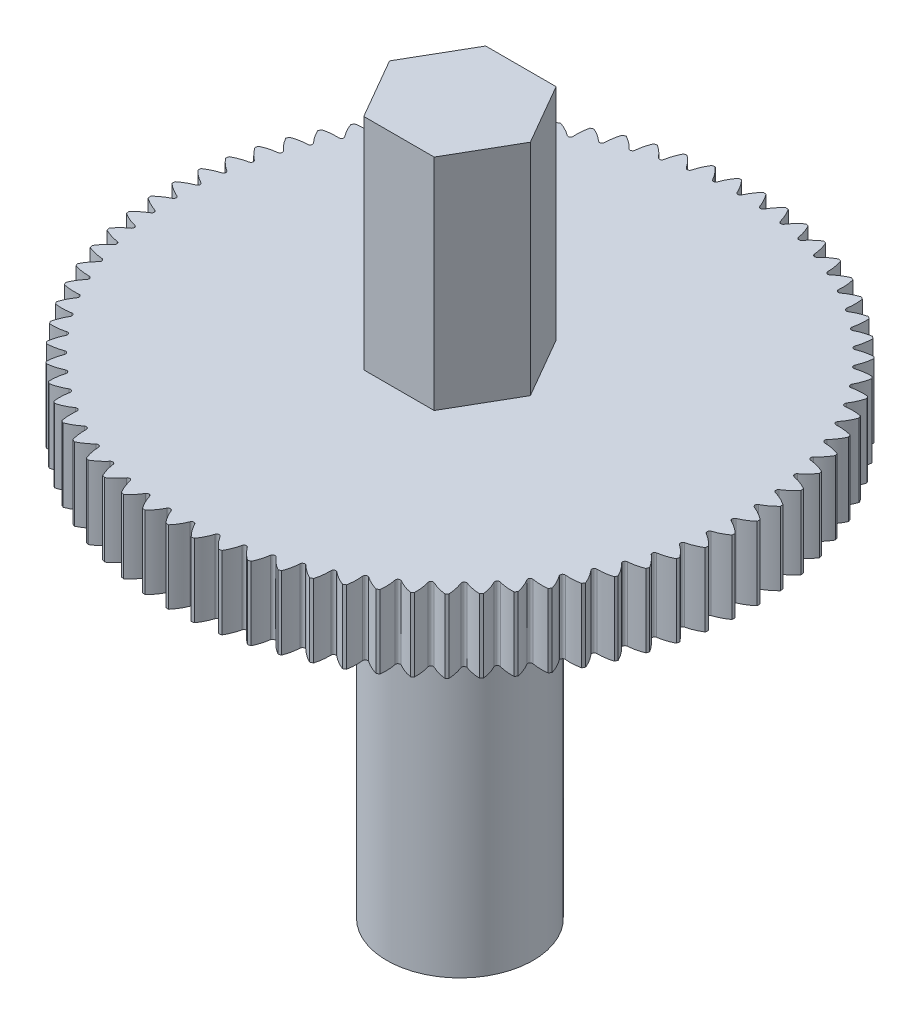
from build123d import *

# Parameters (mm, degrees)
KES_EKSTR_ZYON1_DEPTH = 6
KES_EKSTR_ZYON2_START = -9
IZIM3_R               = 3
KES_EKSTR_ZYON2_DEPTH = 9


with BuildPart() as part:
    # Çizim1 → Döndür1 (revolve)
    with BuildSketch(Plane.XY, mode=Mode.PRIVATE) as d_nd_r1_sk:
        Polygon((0, 0), (0, 29), (3, 29), (3, 20), (12, 20), (12, 17), (3, 17), (3, 0), align=None)
    revolve(d_nd_r1_sk.sketch.rotate(Axis((0, 0, 0), (0, 1, 0)), 90), axis=Axis((0, 0, 0), (0, 1, 0)))

    # Çizim2 → Kes-Ekstrüzyon1 (cut)
    with BuildSketch(Plane(origin=(0, 20, 0), x_dir=(1, 0, 0), z_dir=(0, 1, 0))):
        with BuildLine():
            Line((0.45, 12), (-0.45, 12))
            ThreePointArc((-0.45, 12), (-0.248504486, 11.744148972), (-0.091203345, 11.458988418))
            ThreePointArc((-0.091203345, 11.458988418), (0, 11.4), (0.091203345, 11.458988418))
            ThreePointArc((0.091203345, 11.458988418), (0.248504486, 11.744148972), (0.45, 12))
        make_face()
        with BuildLine():
            Line((1.452555907, 11.920259281), (0.555712333, 11.99556934))
            ThreePointArc((0.555712333, 11.99556934), (0.735092112, 11.723754908), (0.867979956, 11.426431832))
            ThreePointArc((0.867979956, 11.426431832), (0.953927414, 11.360018595), (1.04974692, 11.411168434))
            ThreePointArc((1.04974692, 11.411168434), (1.230358003, 11.682166269), (1.452555907, 11.920259281))
        make_face()
        with BuildLine():
            Line((2.444923177, 11.756906509), (1.557526744, 11.906998381))
            ThreePointArc((1.557526744, 11.906998381), (1.713532567, 11.621127127), (1.821075, 11.313727037))
            ThreePointArc((1.821075, 11.313727037), (1.901163713, 11.240354823), (2.000927274, 11.283307301))
            ThreePointArc((2.000927274, 11.283307301), (2.203581444, 11.538241564), (2.444923177, 11.756906509))
        make_face()
        with BuildLine():
            Line((3.420141068, 11.511087484), (2.548416223, 11.734908383))
            ThreePointArc((2.548416223, 11.734908383), (2.679953822, 11.436985489), (2.761396512, 11.121664575))
            ThreePointArc((2.761396512, 11.121664575), (2.835064714, 11.041848037), (2.938072561, 11.076301876))
            ThreePointArc((2.938072561, 11.076301876), (3.161348343, 11.313384384), (3.420141068, 11.511087484))
        make_face()
        with BuildLine():
            Line((4.371369127, 11.184526452), (3.521430394, 11.480506434))
            ThreePointArc((3.521430394, 11.480506434), (3.627577127, 11.172621615), (3.682348812, 10.851591627))
            ThreePointArc((3.682348812, 10.851591627), (3.749079773, 10.765890621), (3.85460938, 10.791604151))
            ThreePointArc((3.85460938, 10.791604151), (4.096940656, 11.009171941), (4.371369127, 11.184526452))
        make_face()
        with BuildLine():
            Line((5.291935173, 10.779514002), (4.469744261, 11.145576981))
            ThreePointArc((4.469744261, 11.145576981), (4.549755585, 10.829889828), (4.577472081, 10.505402561))
            ThreePointArc((4.577472081, 10.505402561), (4.636797731, 10.414418217), (4.744108884, 10.431211076))
            ThreePointArc((4.744108884, 10.431211076), (5.003795873, 10.627738067), (5.291935173, 10.779514002))
        make_face()
        with BuildLine():
            Line((6.175382095, 10.298891007), (5.386706083, 10.732469314))
            ThreePointArc((5.386706083, 10.732469314), (5.440020776, 10.411194145), (5.440487671, 10.085525644))
            ThreePointArc((5.440487671, 10.085525644), (5.491991885, 9.989896153), (5.600331872, 9.997650551))
            ThreePointArc((5.600331872, 9.997650551), (5.875553058, 10.171758247), (6.175382095, 10.298891007))
        make_face()
        with BuildLine():
            Line((7.015513149, 9.746028691), (6.265884033, 10.244081086))
            ThreePointArc((6.265884033, 10.244081086), (6.29212813, 9.919471416), (6.26534215, 9.594906011))
            ThreePointArc((6.26534215, 9.594906011), (6.308663661, 9.495302144), (6.417272557, 9.49396369))
            ThreePointArc((6.417272557, 9.49396369), (6.706097459, 9.644430851), (7.015513149, 9.746028691))
        make_face()
        with BuildLine():
            Line((7.806435419, 9.124804987), (7.101111308, 9.683837989))
            ThreePointArc((7.101111308, 9.683837989), (7.100100726, 9.358170721), (7.046249755, 9.036985006))
            ThreePointArc((7.046249755, 9.036985006), (7.081084695, 8.934105414), (7.189200685, 8.923683495))
            ThreePointArc((7.189200685, 8.923683495), (7.489603405, 9.049454702), (7.806435419, 9.124804987))
        make_face()
        with BuildLine():
            Line((8.542601153, 8.439577331), (7.886529389, 9.055669727))
            ThreePointArc((7.886529389, 9.055669727), (7.858271217, 8.731229183), (7.777732981, 8.415676045))
            ThreePointArc((7.777732981, 8.415676045), (7.803837008, 8.310242353), (7.910701736, 8.290810073))
            ThreePointArc((7.910701736, 8.290810073), (8.220575165, 8.39100313), (8.542601153, 8.439577331))
        make_face()
        with BuildLine():
            Line((9.218846679, 7.695152105), (8.616629133, 8.363982448))
            ThreePointArc((8.616629133, 8.363982448), (8.561321581, 8.043044346), (8.454660999, 7.735337162))
            ThreePointArc((8.454660999, 7.735337162), (8.47185101, 7.628088912), (8.576714898, 7.599782574))
            ThreePointArc((8.576714898, 7.599782574), (8.893885496, 7.6736947), (9.218846679, 7.695152105))
        make_face()
        with BuildLine():
            Line((9.830428618, 6.896750915), (9.286289415, 7.613627841))
            ThreePointArc((9.286289415, 7.613627841), (9.204320426, 7.298443331), (9.072285644, 7.000740448))
            ThreePointArc((9.072285644, 7.000740448), (9.080441065, 6.892429909), (9.182568567, 6.855448062))
            ThreePointArc((9.182568567, 6.855448062), (9.50481161, 6.902560816), (9.830428618, 6.896750915))
        make_face()
        with BuildLine():
            Line((10.373057164, 6.049973973), (9.890813048, 6.809869106))
            ThreePointArc((9.890813048, 6.809869106), (9.782757576, 6.502648981), (9.626274723, 6.217038569))
            ThreePointArc((9.626274723, 6.217038569), (9.625338351, 6.108425463), (9.724013115, 6.063027507))
            ThreePointArc((9.724013115, 6.063027507), (10.049068301, 6.083010427), (10.373057164, 6.049973973))
        make_face()
        with BuildLine():
            Line((10.842926167, 5.160760811), (10.425959735, 5.958344032))
            ThreePointArc((10.425959735, 5.958344032), (10.292575711, 5.661243219), (10.112742402, 5.389728631))
            ThreePointArc((10.112742402, 5.389728631), (10.102720803, 5.2815748), (10.197250699, 5.22807917))
            ThreePointArc((10.197250699, 5.22807917), (10.522837997, 5.22079209), (10.842926167, 5.160760811))
        make_face()
        with BuildLine():
            Line((11.236739833, 4.235348619), (10.887975805, 5.065025456))
            ThreePointArc((10.887975805, 5.065025456), (10.730198823, 4.780127905), (10.528276459, 4.52461362))
            ThreePointArc((10.528276459, 4.52461362), (10.509239928, 4.417677686), (10.598961895, 4.356459614))
            ThreePointArc((10.598961895, 4.356459614), (10.922797546, 4.321953648), (11.236739833, 4.235348619))
        make_face()
        with BuildLine():
            Line((11.551735843, 3.2802285), (11.273620548, 4.136179365))
            ThreePointArc((11.273620548, 4.136179365), (11.092557299, 3.865483427), (10.869962222, 3.627761695))
            ThreePointArc((10.869962222, 3.627761695), (10.842044286, 3.522793736), (10.926328989, 3.454282624))
            ThreePointArc((10.926328989, 3.454282624), (11.246141518, 3.392799806), (11.551735843, 3.2802285))
        make_face()
        with BuildLine():
            Line((11.785704726, 2.302099935), (11.580188943, 3.178320948))
            ThreePointArc((11.580188943, 3.178320948), (11.377109456, 2.923725361), (11.135403009, 2.705463628))
            ThreePointArc((11.135403009, 2.705463628), (11.098799493, 2.603199919), (11.177055735, 2.527876323))
            ThreePointArc((11.177055735, 2.527876323), (11.490601887, 2.439847912), (11.785704726, 2.302099935))
        make_face()
        with BuildLine():
            Line((11.937005358, 1.307823793), (11.805530633, 2.198168893))
            ThreePointArc((11.805530633, 2.198168893), (11.581859365, 1.961459462), (11.322736945, 1.764188678))
            ThreePointArc((11.322736945, 1.764188678), (11.277704596, 1.665346526), (11.349383467, 1.583738786))
            ThreePointArc((11.349383467, 1.583738786), (11.65446394, 1.469782237), (11.937005358, 1.307823793))
        make_face()
        with BuildLine():
            Line((12.004576475, 0.304374207), (11.948065007, 1.202598262))
            ThreePointArc((11.948065007, 1.202598262), (11.705370851, 0.985435334), (11.430650017, 0.810539212))
            ThreePointArc((11.430650017, 0.810539212), (11.377504704, 0.715811923), (11.442103427, 0.62849246))
            ThreePointArc((11.442103427, 0.62849246), (11.736578303, 0.489407097), (12.004576475, 0.304374207))
        make_face()
        with BuildLine():
            Line((11.987944113, -0.701210346), (12.006792291, 0.198592269))
            ThreePointArc((12.006792291, 0.198592269), (11.746777572, 0.002499086), (11.458385291, -0.148795604))
            ThreePointArc((11.458385291, -0.148795604), (11.397499792, -0.238743587), (11.454565254, -0.33116229))
            ThreePointArc((11.454565254, -0.33116229), (11.736369001, -0.494400884), (11.987944113, -0.701210346))
        make_face()
        with BuildLine():
            Line((11.887224936, -1.701876412), (11.981300553, -0.806806706))
            ThreePointArc((11.981300553, -0.806806706), (11.705789087, -0.980454692), (11.405748226, -1.107086726))
            ThreePointArc((11.405748226, -1.107086726), (11.337549607, -1.191624481), (11.386681535, -1.288494174))
            ThreePointArc((11.386681535, -1.288494174), (11.653837503, -1.474740997), (11.887224936, -1.701876412))
        make_face()
        with BuildLine():
            Line((11.703125417, -2.690605038), (11.8717686, -1.806546512))
            ThreePointArc((11.8717686, -1.806546512), (11.582692903, -1.956531285), (11.273108032, -2.057612431))
            ThreePointArc((11.273108032, -2.057612431), (11.198074658, -2.136146986), (11.238928427, -2.236788197))
            ThreePointArc((11.238928427, -2.236788197), (11.489562709, -2.444736861), (11.703125417, -2.690605038))
        make_face()
        with BuildLine():
            Line((11.436936882, -3.660461002), (11.678964721, -2.793614692))
            ThreePointArc((11.678964721, -2.793614692), (11.378352451, -2.918884217), (11.061395085, -2.993705462))
            ThreePointArc((11.061395085, -2.993705462), (10.980053261, -3.065685955), (11.01234231, -3.169392758))
            ThreePointArc((11.01234231, -3.169392758), (11.244696887, -3.397584653), (11.436936882, -3.660461002))
        make_face()
        with BuildLine():
            Line((11.090526453, -4.604641463), (11.404241295, -3.761087673))
            ThreePointArc((11.404241295, -3.761087673), (11.094201031, -3.860763273), (10.772094399, -3.9087998))
            ThreePointArc((10.772094399, -3.9087998), (10.68501468, -3.973721339), (10.708512525, -4.079766306))
            ThreePointArc((10.708512525, -4.079766306), (10.920957596, -4.32660083), (11.090526453, -4.604641463))
        make_face()
        with BuildLine():
            Line((10.666323948, -5.516523672), (11.049525311, -4.702179325))
            ThreePointArc((11.049525311, -4.702179325), (10.732231762, -4.775561848), (10.40723521, -4.796476717))
            ThreePointArc((10.40723521, -4.796476717), (10.315028398, -4.853883924), (10.329570219, -4.961523225))
            ThreePointArc((10.329570219, -4.961523225), (10.520615634, -5.225269011), (10.666323948, -5.516523672))
        make_face()
        with BuildLine():
            Line((10.167304845, -6.389711432), (10.617304845, -5.610288568))
            ThreePointArc((10.617304845, -5.610288568), (10.294983599, -5.656863289), (9.969376744, -5.650509795))
            ThreePointArc((9.969376744, -5.650509795), (9.872689603, -5.7), (9.878173399, -5.808478623))
            ThreePointArc((9.878173399, -5.808478623), (10.046479113, -6.087285684), (10.167304845, -6.389711432))
        make_face()
        with BuildLine():
            Line((9.596969404, -7.218079956), (10.110611615, -6.479045668))
            ThreePointArc((10.110611615, -6.479045668), (9.785523522, -6.498485898), (9.461590263, -6.464908607))
            ThreePointArc((9.461590263, -6.464908607), (9.361100984, -6.506134672), (9.357488291, -6.614691717))
            ThreePointArc((9.357488291, -6.614691717), (9.501873759, -6.906604421), (9.596969404, -7.218079956))
        make_face()
        with BuildLine():
            Line((8.959318118, -7.995818836), (9.532999709, -7.302356918))
            ThreePointArc((9.532999709, -7.302356918), (9.207425029, -7.294526297), (8.887437525, -7.233960731))
            ThreePointArc((8.887437525, -7.233960731), (8.783850968, -7.266633483), (8.771167125, -7.374507501))
            ThreePointArc((8.771167125, -7.374507501), (8.890619588, -7.677478291), (8.959318118, -7.995818836))
        make_face()
        with BuildLine():
            Line((8.258823652, -8.717472792), (8.888520659, -8.07444738))
            ThreePointArc((8.888520659, -8.07444738), (8.564743065, -8.039400836), (8.250945798, -7.952271817))
            ThreePointArc((8.250945798, -7.952271817), (8.144988548, -7.976162082), (8.123322524, -8.082596414))
            ThreePointArc((8.123322524, -8.082596414), (8.217004108, -8.394500167), (8.258823652, -8.717472792))
        make_face()
        with BuildLine():
            Line((7.500399473, -9.37797994), (8.181695023, -8.789901396))
            ThreePointArc((8.181695023, -8.789901396), (7.861985582, -8.727884754), (7.556579614, -8.61480343))
            ThreePointArc((7.556579614, -8.61480343), (7.448994885, -8.629743634), (7.418498652, -8.73399172))
            ThreePointArc((7.418498652, -8.73399172), (7.485752248, -9.052640656), (7.500399473, -9.37797994))
        make_face()
        with BuildLine():
            Line((6.68936538, -9.972707296), (7.417480675, -9.443700569))
            ThreePointArc((7.417480675, -9.443700569), (7.104081919, -9.355148831), (6.809209454, -9.216908387))
            ThreePointArc((6.809209454, -9.216908387), (6.700751876, -9.222793736), (6.661639342, -9.32412435))
            ThreePointArc((6.661639342, -9.32412435), (6.701993215, -9.647283375), (6.68936538, -9.972707296))
        make_face()
        with BuildLine():
            Line((5.831410195, -10.497483276), (6.60123803, -10.031258968))
            ThreePointArc((6.60123803, -10.031258968), (6.296348225, -9.916793261), (6.014077582, -9.754363354))
            ThreePointArc((6.014077582, -9.754363354), (5.905507907, -9.751152566), (5.858053419, -9.848854946))
            ThreePointArc((5.858053419, -9.848854946), (5.871224514, -10.174257333), (5.831410195, -10.497483276))
        make_face()
        with BuildLine():
            Line((4.932551858, -10.948626954), (5.738692442, -10.548455292))
            ThreePointArc((5.738692442, -10.548455292), (5.444450173, -10.408878512), (5.176761277, -10.223398471))
            ThreePointArc((5.176761277, -10.223398471), (5.068841043, -10.211114067), (5.01337746, -10.304502902))
            ThreePointArc((5.01337746, -10.304502902), (4.999273392, -10.629866185), (4.932551858, -10.948626954))
        make_face()
        with BuildLine():
            Line((3.999095214, -11.322973879), (4.835894051, -10.991661782))
            ThreePointArc((4.835894051, -10.991661782), (4.554363215, -10.827952959), (4.303133711, -10.620723793))
            ThreePointArc((4.303133711, -10.620723793), (4.196619901, -10.599451939), (4.13353626, -10.687872174))
            ThreePointArc((4.13353626, -10.687872174), (4.09225596, -11.010914164), (3.999095214, -11.322973879))
        make_face()
        with BuildLine():
            Line((3.037587789, -11.617898279), (3.899175337, -11.357769662))
            ThreePointArc((3.899175337, -11.357769662), (3.63233067, -11.171077095), (3.399322754, -10.943552368))
            ThreePointArc((3.399322754, -10.943552368), (3.294962485, -10.913442272), (3.224701273, -10.996273701))
            ThreePointArc((3.224701273, -10.996273701), (3.156534292, -11.314728491), (3.037587789, -11.617898279))
        make_face()
        with BuildLine():
            Line((2.054773869, -11.83133147), (2.93510671, -11.644210948))
            ThreePointArc((2.93510671, -11.644210948), (2.684819937, -11.435844152), (2.47166799, -11.189619786))
            ThreePointArc((2.47166799, -11.189619786), (2.370193275, -11.150882648), (2.293247324, -11.22754427))
            ThreePointArc((2.293247324, -11.22754427), (2.198671804, -11.539178128), (2.054773869, -11.83133147))
        make_face()
        with BuildLine():
            Line((1.057547187, -11.961776371), (1.950450418, -11.848976461))
            ThreePointArc((1.950450418, -11.848976461), (1.71847712, -11.620396979), (1.526676251, -11.357200062))
            ThreePointArc((1.526676251, -11.357200062), (1.428798863, -11.310107595), (1.345707892, -11.380061682))
            ThreePointArc((1.345707892, -11.380061682), (1.225387213, -11.682688721), (1.057547187, -11.961776371))
        make_face()
        with BuildLine():
            Line((0.052902571, -12.008318005), (0.952113118, -11.970629917))
            ThreePointArc((0.952113118, -11.970629917), (0.740080421, -11.723441071), (0.570975975, -11.445117739))
            ThreePointArc((0.570975975, -11.445117739), (0.477382453, -11.390000263), (0.388729287, -11.452756138))
            ThreePointArc((0.388729287, -11.452756138), (0.243507411, -11.744253646), (0.052902571, -12.008318005))
        make_face()
        with BuildLine():
            Line((-0.952113118, -11.970629917), (-0.052902571, -12.008318005))
            ThreePointArc((-0.052902571, -12.008318005), (-0.243507411, -11.744253646), (-0.388729287, -11.452756138))
            ThreePointArc((-0.388729287, -11.452756138), (-0.477382453, -11.390000263), (-0.570975975, -11.445117739))
            ThreePointArc((-0.570975975, -11.445117739), (-0.740080421, -11.723441071), (-0.952113118, -11.970629917))
        make_face()
        with BuildLine():
            Line((-1.950450418, -11.848976461), (-1.057547187, -11.961776371))
            ThreePointArc((-1.057547187, -11.961776371), (-1.225387213, -11.682688721), (-1.345707892, -11.380061682))
            ThreePointArc((-1.345707892, -11.380061682), (-1.428798863, -11.310107595), (-1.526676251, -11.357200062))
            ThreePointArc((-1.526676251, -11.357200062), (-1.71847712, -11.620396979), (-1.950450418, -11.848976461))
        make_face()
        with BuildLine():
            Line((-2.93510671, -11.644210948), (-2.054773869, -11.83133147))
            ThreePointArc((-2.054773869, -11.83133147), (-2.198671804, -11.539178128), (-2.293247324, -11.22754427))
            ThreePointArc((-2.293247324, -11.22754427), (-2.370193275, -11.150882648), (-2.47166799, -11.189619786))
            ThreePointArc((-2.47166799, -11.189619786), (-2.684819937, -11.435844152), (-2.93510671, -11.644210948))
        make_face()
        with BuildLine():
            Line((-3.899175337, -11.357769662), (-3.037587789, -11.617898279))
            ThreePointArc((-3.037587789, -11.617898279), (-3.156534292, -11.314728491), (-3.224701273, -10.996273701))
            ThreePointArc((-3.224701273, -10.996273701), (-3.294962485, -10.913442272), (-3.399322754, -10.943552368))
            ThreePointArc((-3.399322754, -10.943552368), (-3.63233067, -11.171077095), (-3.899175337, -11.357769662))
        make_face()
        with BuildLine():
            Line((-4.835894051, -10.991661782), (-3.999095214, -11.322973879))
            ThreePointArc((-3.999095214, -11.322973879), (-4.09225596, -11.010914164), (-4.13353626, -10.687872174))
            ThreePointArc((-4.13353626, -10.687872174), (-4.196619901, -10.599451939), (-4.303133711, -10.620723793))
            ThreePointArc((-4.303133711, -10.620723793), (-4.554363215, -10.827952959), (-4.835894051, -10.991661782))
        make_face()
        with BuildLine():
            Line((-5.738692442, -10.548455292), (-4.932551858, -10.948626954))
            ThreePointArc((-4.932551858, -10.948626954), (-4.999273392, -10.629866185), (-5.01337746, -10.304502902))
            ThreePointArc((-5.01337746, -10.304502902), (-5.068841043, -10.211114067), (-5.176761277, -10.223398471))
            ThreePointArc((-5.176761277, -10.223398471), (-5.444450173, -10.408878512), (-5.738692442, -10.548455292))
        make_face()
        with BuildLine():
            Line((-6.60123803, -10.031258968), (-5.831410195, -10.497483276))
            ThreePointArc((-5.831410195, -10.497483276), (-5.871224514, -10.174257333), (-5.858053419, -9.848854946))
            ThreePointArc((-5.858053419, -9.848854946), (-5.905507907, -9.751152566), (-6.014077582, -9.754363354))
            ThreePointArc((-6.014077582, -9.754363354), (-6.296348225, -9.916793261), (-6.60123803, -10.031258968))
        make_face()
        with BuildLine():
            Line((-7.417480675, -9.443700569), (-6.68936538, -9.972707296))
            ThreePointArc((-6.68936538, -9.972707296), (-6.701993215, -9.647283375), (-6.661639342, -9.32412435))
            ThreePointArc((-6.661639342, -9.32412435), (-6.700751876, -9.222793736), (-6.809209454, -9.216908387))
            ThreePointArc((-6.809209454, -9.216908387), (-7.104081919, -9.355148831), (-7.417480675, -9.443700569))
        make_face()
        with BuildLine():
            Line((-8.181695023, -8.789901396), (-7.500399473, -9.37797994))
            ThreePointArc((-7.500399473, -9.37797994), (-7.485752248, -9.052640656), (-7.418498652, -8.73399172))
            ThreePointArc((-7.418498652, -8.73399172), (-7.448994885, -8.629743634), (-7.556579614, -8.61480343))
            ThreePointArc((-7.556579614, -8.61480343), (-7.861985582, -8.727884754), (-8.181695023, -8.789901396))
        make_face()
        with BuildLine():
            Line((-8.888520659, -8.07444738), (-8.258823652, -8.717472792))
            ThreePointArc((-8.258823652, -8.717472792), (-8.217004108, -8.394500167), (-8.123322524, -8.082596414))
            ThreePointArc((-8.123322524, -8.082596414), (-8.144988548, -7.976162082), (-8.250945798, -7.952271817))
            ThreePointArc((-8.250945798, -7.952271817), (-8.564743065, -8.039400836), (-8.888520659, -8.07444738))
        make_face()
        with BuildLine():
            Line((-9.532999709, -7.302356918), (-8.959318118, -7.995818836))
            ThreePointArc((-8.959318118, -7.995818836), (-8.890619588, -7.677478291), (-8.771167125, -7.374507501))
            ThreePointArc((-8.771167125, -7.374507501), (-8.783850968, -7.266633483), (-8.887437525, -7.233960731))
            ThreePointArc((-8.887437525, -7.233960731), (-9.207425029, -7.294526297), (-9.532999709, -7.302356918))
        make_face()
        with BuildLine():
            Line((-10.110611615, -6.479045668), (-9.596969404, -7.218079956))
            ThreePointArc((-9.596969404, -7.218079956), (-9.501873759, -6.906604421), (-9.357488291, -6.614691717))
            ThreePointArc((-9.357488291, -6.614691717), (-9.361100984, -6.506134672), (-9.461590263, -6.464908607))
            ThreePointArc((-9.461590263, -6.464908607), (-9.785523522, -6.498485898), (-10.110611615, -6.479045668))
        make_face()
        with BuildLine():
            Line((-10.617304845, -5.610288568), (-10.167304845, -6.389711432))
            ThreePointArc((-10.167304845, -6.389711432), (-10.046479113, -6.087285684), (-9.878173399, -5.808478623))
            ThreePointArc((-9.878173399, -5.808478623), (-9.872689603, -5.7), (-9.969376744, -5.650509795))
            ThreePointArc((-9.969376744, -5.650509795), (-10.294983599, -5.656863289), (-10.617304845, -5.610288568))
        make_face()
        with BuildLine():
            Line((-11.049525311, -4.702179325), (-10.666323948, -5.516523672))
            ThreePointArc((-10.666323948, -5.516523672), (-10.520615634, -5.225269011), (-10.329570219, -4.961523225))
            ThreePointArc((-10.329570219, -4.961523225), (-10.315028398, -4.853883924), (-10.40723521, -4.796476717))
            ThreePointArc((-10.40723521, -4.796476717), (-10.732231762, -4.775561848), (-11.049525311, -4.702179325))
        make_face()
        with BuildLine():
            Line((-11.404241295, -3.761087673), (-11.090526453, -4.604641463))
            ThreePointArc((-11.090526453, -4.604641463), (-10.920957596, -4.32660083), (-10.708512525, -4.079766306))
            ThreePointArc((-10.708512525, -4.079766306), (-10.68501468, -3.973721339), (-10.772094399, -3.9087998))
            ThreePointArc((-10.772094399, -3.9087998), (-11.094201031, -3.860763273), (-11.404241295, -3.761087673))
        make_face()
        with BuildLine():
            Line((-11.678964721, -2.793614692), (-11.436936882, -3.660461002))
            ThreePointArc((-11.436936882, -3.660461002), (-11.244696887, -3.397584653), (-11.01234231, -3.169392758))
            ThreePointArc((-11.01234231, -3.169392758), (-10.980053261, -3.065685955), (-11.061395085, -2.993705462))
            ThreePointArc((-11.061395085, -2.993705462), (-11.378352451, -2.918884217), (-11.678964721, -2.793614692))
        make_face()
        with BuildLine():
            Line((-11.8717686, -1.806546512), (-11.703125417, -2.690605038))
            ThreePointArc((-11.703125417, -2.690605038), (-11.489562709, -2.444736861), (-11.238928427, -2.236788197))
            ThreePointArc((-11.238928427, -2.236788197), (-11.198074658, -2.136146986), (-11.273108032, -2.057612431))
            ThreePointArc((-11.273108032, -2.057612431), (-11.582692903, -1.956531285), (-11.8717686, -1.806546512))
        make_face()
        with BuildLine():
            Line((-11.981300553, -0.806806706), (-11.887224936, -1.701876412))
            ThreePointArc((-11.887224936, -1.701876412), (-11.653837503, -1.474740997), (-11.386681535, -1.288494174))
            ThreePointArc((-11.386681535, -1.288494174), (-11.337549607, -1.191624481), (-11.405748226, -1.107086726))
            ThreePointArc((-11.405748226, -1.107086726), (-11.705789087, -0.980454692), (-11.981300553, -0.806806706))
        make_face()
        with BuildLine():
            Line((-12.006792291, 0.198592269), (-11.987944113, -0.701210346))
            ThreePointArc((-11.987944113, -0.701210346), (-11.736369001, -0.494400884), (-11.454565254, -0.33116229))
            ThreePointArc((-11.454565254, -0.33116229), (-11.397499792, -0.238743587), (-11.458385291, -0.148795604))
            ThreePointArc((-11.458385291, -0.148795604), (-11.746777572, 0.002499086), (-12.006792291, 0.198592269))
        make_face()
        with BuildLine():
            Line((-11.948065007, 1.202598262), (-12.004576475, 0.304374207))
            ThreePointArc((-12.004576475, 0.304374207), (-11.736578303, 0.489407096), (-11.442103427, 0.62849246))
            ThreePointArc((-11.442103427, 0.62849246), (-11.377504704, 0.715811923), (-11.430650017, 0.810539212))
            ThreePointArc((-11.430650017, 0.810539212), (-11.705370851, 0.985435334), (-11.948065007, 1.202598262))
        make_face()
        with BuildLine():
            Line((-11.805530633, 2.198168893), (-11.937005358, 1.307823793))
            ThreePointArc((-11.937005358, 1.307823793), (-11.65446394, 1.469782237), (-11.349383467, 1.583738786))
            ThreePointArc((-11.349383467, 1.583738786), (-11.277704596, 1.665346526), (-11.322736945, 1.764188678))
            ThreePointArc((-11.322736945, 1.764188678), (-11.581859365, 1.961459462), (-11.805530633, 2.198168893))
        make_face()
        with BuildLine():
            Line((-11.580188943, 3.178320948), (-11.785704726, 2.302099935))
            ThreePointArc((-11.785704726, 2.302099935), (-11.490601887, 2.439847912), (-11.177055735, 2.527876323))
            ThreePointArc((-11.177055735, 2.527876323), (-11.098799493, 2.603199919), (-11.135403009, 2.705463628))
            ThreePointArc((-11.135403009, 2.705463628), (-11.377109456, 2.923725361), (-11.580188943, 3.178320948))
        make_face()
        with BuildLine():
            Line((-11.273620548, 4.136179365), (-11.551735843, 3.2802285))
            ThreePointArc((-11.551735843, 3.2802285), (-11.246141518, 3.392799806), (-10.926328989, 3.454282624))
            ThreePointArc((-10.926328989, 3.454282624), (-10.842044286, 3.522793736), (-10.869962222, 3.627761695))
            ThreePointArc((-10.869962222, 3.627761695), (-11.092557299, 3.865483427), (-11.273620548, 4.136179365))
        make_face()
        with BuildLine():
            Line((-10.887975805, 5.065025456), (-11.236739833, 4.235348619))
            ThreePointArc((-11.236739833, 4.235348619), (-10.922797546, 4.321953648), (-10.598961895, 4.356459614))
            ThreePointArc((-10.598961895, 4.356459614), (-10.509239928, 4.417677686), (-10.528276459, 4.52461362))
            ThreePointArc((-10.528276459, 4.52461362), (-10.730198823, 4.780127905), (-10.887975805, 5.065025456))
        make_face()
        with BuildLine():
            Line((-10.425959735, 5.958344032), (-10.842926167, 5.160760811))
            ThreePointArc((-10.842926167, 5.160760811), (-10.522837997, 5.22079209), (-10.197250699, 5.22807917))
            ThreePointArc((-10.197250699, 5.22807917), (-10.102720803, 5.2815748), (-10.112742402, 5.389728631))
            ThreePointArc((-10.112742402, 5.389728631), (-10.292575711, 5.661243219), (-10.425959735, 5.958344032))
        make_face()
        with BuildLine():
            Line((-9.890813048, 6.809869106), (-10.373057164, 6.049973973))
            ThreePointArc((-10.373057164, 6.049973973), (-10.049068301, 6.083010427), (-9.724013115, 6.063027507))
            ThreePointArc((-9.724013115, 6.063027507), (-9.625338351, 6.108425463), (-9.626274723, 6.217038569))
            ThreePointArc((-9.626274723, 6.217038569), (-9.782757576, 6.502648981), (-9.890813048, 6.809869106))
        make_face()
        with BuildLine():
            Line((-9.286289415, 7.613627841), (-9.830428618, 6.896750915))
            ThreePointArc((-9.830428618, 6.896750915), (-9.50481161, 6.902560816), (-9.182568567, 6.855448062))
            ThreePointArc((-9.182568567, 6.855448062), (-9.080441065, 6.892429909), (-9.072285644, 7.000740448))
            ThreePointArc((-9.072285644, 7.000740448), (-9.204320426, 7.298443331), (-9.286289415, 7.613627841))
        make_face()
        with BuildLine():
            Line((-8.616629133, 8.363982448), (-9.218846679, 7.695152105))
            ThreePointArc((-9.218846679, 7.695152105), (-8.893885496, 7.6736947), (-8.576714898, 7.599782574))
            ThreePointArc((-8.576714898, 7.599782574), (-8.47185101, 7.628088912), (-8.454660999, 7.735337162))
            ThreePointArc((-8.454660999, 7.735337162), (-8.561321581, 8.043044346), (-8.616629133, 8.363982448))
        make_face()
        with BuildLine():
            Line((-7.886529389, 9.055669727), (-8.542601153, 8.439577331))
            ThreePointArc((-8.542601153, 8.439577331), (-8.220575165, 8.39100313), (-7.910701736, 8.290810073))
            ThreePointArc((-7.910701736, 8.290810073), (-7.803837008, 8.310242353), (-7.777732981, 8.415676045))
            ThreePointArc((-7.777732981, 8.415676045), (-7.858271217, 8.731229183), (-7.886529389, 9.055669727))
        make_face()
        with BuildLine():
            Line((-7.101111308, 9.683837989), (-7.806435419, 9.124804987))
            ThreePointArc((-7.806435419, 9.124804987), (-7.489603405, 9.049454702), (-7.189200685, 8.923683495))
            ThreePointArc((-7.189200685, 8.923683495), (-7.081084695, 8.934105414), (-7.046249755, 9.036985006))
            ThreePointArc((-7.046249755, 9.036985006), (-7.100100726, 9.358170721), (-7.101111308, 9.683837989))
        make_face()
        with BuildLine():
            Line((-6.265884033, 10.244081086), (-7.015513149, 9.746028691))
            ThreePointArc((-7.015513149, 9.746028691), (-6.706097459, 9.644430851), (-6.417272557, 9.49396369))
            ThreePointArc((-6.417272557, 9.49396369), (-6.308663661, 9.495302144), (-6.26534215, 9.594906011))
            ThreePointArc((-6.26534215, 9.594906011), (-6.29212813, 9.919471416), (-6.265884033, 10.244081086))
        make_face()
        with BuildLine():
            Line((-5.386706083, 10.732469314), (-6.175382095, 10.298891007))
            ThreePointArc((-6.175382095, 10.298891007), (-5.875553058, 10.171758247), (-5.600331872, 9.997650551))
            ThreePointArc((-5.600331872, 9.997650551), (-5.491991885, 9.989896153), (-5.440487671, 10.085525644))
            ThreePointArc((-5.440487671, 10.085525644), (-5.440020776, 10.411194145), (-5.386706083, 10.732469314))
        make_face()
        with BuildLine():
            Line((-4.469744261, 11.145576981), (-5.291935173, 10.779514002))
            ThreePointArc((-5.291935173, 10.779514002), (-5.003795873, 10.627738067), (-4.744108884, 10.431211076))
            ThreePointArc((-4.744108884, 10.431211076), (-4.636797731, 10.414418217), (-4.577472081, 10.505402561))
            ThreePointArc((-4.577472081, 10.505402561), (-4.549755585, 10.829889828), (-4.469744261, 11.145576981))
        make_face()
        with BuildLine():
            Line((-3.521430394, 11.480506434), (-4.371369127, 11.184526452))
            ThreePointArc((-4.371369127, 11.184526452), (-4.096940656, 11.009171941), (-3.85460938, 10.791604151))
            ThreePointArc((-3.85460938, 10.791604151), (-3.749079773, 10.765890621), (-3.682348812, 10.851591627))
            ThreePointArc((-3.682348812, 10.851591627), (-3.627577127, 11.172621615), (-3.521430394, 11.480506434))
        make_face()
        with BuildLine():
            Line((-2.548416223, 11.734908383), (-3.420141068, 11.511087484))
            ThreePointArc((-3.420141068, 11.511087484), (-3.161348343, 11.313384384), (-2.938072561, 11.076301876))
            ThreePointArc((-2.938072561, 11.076301876), (-2.835064714, 11.041848037), (-2.761396512, 11.121664575))
            ThreePointArc((-2.761396512, 11.121664575), (-2.679953822, 11.436985489), (-2.548416223, 11.734908383))
        make_face()
        with BuildLine():
            Line((-1.557526744, 11.906998381), (-2.444923177, 11.756906509))
            ThreePointArc((-2.444923177, 11.756906509), (-2.203581444, 11.538241564), (-2.000927274, 11.283307301))
            ThreePointArc((-2.000927274, 11.283307301), (-1.901163713, 11.240354823), (-1.821075, 11.313727037))
            ThreePointArc((-1.821075, 11.313727037), (-1.713532567, 11.621127127), (-1.557526744, 11.906998381))
        make_face()
        with BuildLine():
            Line((-0.555712333, 11.99556934), (-1.452555907, 11.920259281))
            ThreePointArc((-1.452555907, 11.920259281), (-1.230358003, 11.682166269), (-1.04974692, 11.411168434))
            ThreePointArc((-1.04974692, 11.411168434), (-0.953927414, 11.360018595), (-0.867979956, 11.426431832))
            ThreePointArc((-0.867979956, 11.426431832), (-0.735092112, 11.723754908), (-0.555712333, 11.99556934))
        make_face()
    extrude(amount=-KES_EKSTR_ZYON1_DEPTH, mode=Mode.SUBTRACT)

    # Çizim3 → Kes-Ekstrüzyon2 (cut)
    with BuildSketch(Plane(origin=(0, 29, 0), x_dir=(1, 0, 0), z_dir=(0, 1, 0)).offset(KES_EKSTR_ZYON2_START)):
        with Locations(Location((0, 0, 0), (0, 0, 90))):
            Circle(IZIM3_R)
        Polygon((-1.443375673, -2.5), (1.443375673, -2.5), (2.886751346, 0), (1.443375673, 2.5), (-1.443375673, 2.5), (-2.886751346, 0), align=None, mode=Mode.SUBTRACT)
    extrude(amount=KES_EKSTR_ZYON2_DEPTH, mode=Mode.SUBTRACT)


solid = part.part
